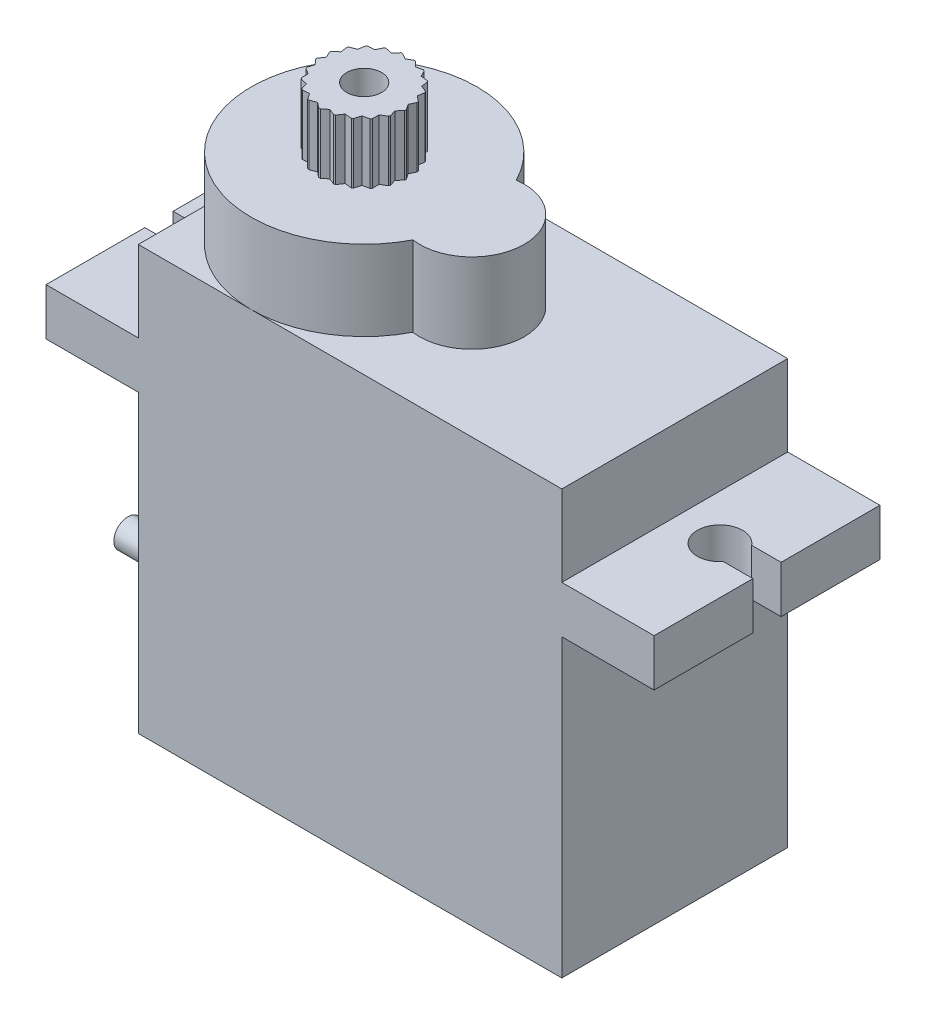
from build123d import *

# Parameters (mm, degrees)
SKETCH1_W           = 22.5
SKETCH1_H           = 12
BOSS_EXTRUDE1_DEPTH = 11.25
SKETCH3_R           = 6
SKETCH3_R_2         = 2.777492364
BOSS_EXTRUDE3_DEPTH = 4.25
SKETCH4_W           = 4.9
SKETCH4_H           = 12
BOSS_EXTRUDE4_DEPTH = 2.5
SKETCH5_R           = 1.2
CUT_EXTRUDE1_DEPTH  = 2.5
SKETCH6_R           = 0.75
BOSS_EXTRUDE5_DEPTH = 5
SKETCH7_R           = 2.375
BOSS_EXTRUDE6_DEPTH = 3.2
CUT_EXTRUDE2_START  = -3.2
CUT_EXTRUDE2_DEPTH  = 3.2
SKETCH9_R           = 0.925
CUT_EXTRUDE3_DEPTH  = 3.2


with BuildPart() as part:
    # Sketch1 → Boss-Extrude1 (new, symmetric)
    with BuildSketch(Plane(origin=(0, 0, 0), x_dir=(1, 0, 0), z_dir=(0, 1, 0))):
        Rectangle(SKETCH1_W, SKETCH1_H)
    extrude(amount=BOSS_EXTRUDE1_DEPTH, both=True)

    # Sketch3 → Boss-Extrude3 (add)
    with BuildSketch(Plane(origin=(0, 11.25, 0), x_dir=(1, 0, 0), z_dir=(0, 1, 0))):
        with Locations((-5.25, 0)):
            Circle(SKETCH3_R)
        with Locations((0.472507636, 0)):
            Circle(SKETCH3_R_2)
    extrude(amount=BOSS_EXTRUDE3_DEPTH)

    # Sketch4 → Boss-Extrude4 (add)
    with BuildSketch(Plane(origin=(0, 6.95, 0), x_dir=(1, 0, 0), z_dir=(0, 1, 0))):
        with Locations((13.7, 0)):
            Rectangle(SKETCH4_W, SKETCH4_H)
    boss_extrude4 = extrude(amount=-BOSS_EXTRUDE4_DEPTH)

    # Sketch5 → Cut-Extrude1 (cut)
    with BuildSketch(Plane(origin=(0, 6.95, 0), x_dir=(1, 0, 0), z_dir=(0, 1, 0))):
        with BuildLine():
            Line((16.15, -0.75), (16.15, 0.75))
            Line((16.15, 0.75), (14.5867497, 0.75))
            ThreePointArc((14.5867497, 0.75), (14.782276388, 0.397429466), (14.85, 0))
            ThreePointArc((14.85, 0), (14.782276388, -0.397429466), (14.5867497, -0.75))
            Line((14.5867497, -0.75), (16.15, -0.75))
        make_face()
        with Locations((13.65, 0)):
            Circle(SKETCH5_R)
    cut_extrude1 = extrude(amount=-CUT_EXTRUDE1_DEPTH, mode=Mode.SUBTRACT)

    # Mirror1: Boss-Extrude4, Cut-Extrude1 across plane
    add(boss_extrude4.mirror(Plane(origin=(0, 0, 0), x_dir=(0, 0, 1), z_dir=(1, 0, 0))))
    add(cut_extrude1.mirror(Plane(origin=(0, 0, 0), x_dir=(0, 0, 1), z_dir=(1, 0, 0))), mode=Mode.SUBTRACT)

    # Sketch6 → Boss-Extrude5 (add)
    with BuildSketch(Plane.ZY.offset(11.25)):
        with Locations(Location((0, -6.75, 0), (0, 0, 180))):
            Circle(SKETCH6_R)
        with Locations(Location((1.55, -6.75, 0), (0, 0, 180))):
            Circle(SKETCH6_R)
        with Locations(Location((-1.55, -6.75, 0), (0, 0, 180))):
            Circle(SKETCH6_R)
    extrude(amount=BOSS_EXTRUDE5_DEPTH)

    # Sketch7 → Boss-Extrude6 (add)
    with BuildSketch(Plane(origin=(0, 15.5, 0), x_dir=(1, 0, 0), z_dir=(0, 1, 0))):
        with Locations(Location((-5.25, 0, 0), (0, 0, 270))):
            Circle(SKETCH7_R)
    extrude(amount=BOSS_EXTRUDE6_DEPTH)

    # Sketch8 → Cut-Extrude2 (cut)
    with BuildSketch(Plane(origin=(0, 18.7, 0), x_dir=(1, 0, 0), z_dir=(0, 1, 0)).offset(CUT_EXTRUDE2_START)):
        with BuildLine():
            ThreePointArc((-4.939008874, 2.354550811), (-5.25, 2.375), (-5.560991126, 2.354550811))
            Line((-5.560991126, 2.354550811), (-5.25, 2.175))
            Line((-5.25, 2.175), (-4.939008874, 2.354550811))
        make_face()
        with BuildLine():
            ThreePointArc((-4.258809302, 2.158278481), (-4.549956461, 2.269485414), (-4.853158628, 2.341610968))
            Line((-4.853158628, 2.341610968), (-4.608907496, 2.078370853))
            Line((-4.608907496, 2.078370853), (-4.258809302, 2.158278481))
        make_face()
        with BuildLine():
            ThreePointArc((-3.666681374, 1.770233636), (-3.912114862, 1.962317089), (-4.180587228, 2.120608715))
            Line((-4.180587228, 2.120608715), (-4.024778874, 1.797069334))
            Line((-4.024778874, 1.797069334), (-3.666681374, 1.770233636))
        make_face()
        with BuildLine():
            ThreePointArc((-3.215238254, 1.224895765), (-3.393150229, 1.480788279), (-3.603037845, 1.711181072))
            Line((-3.603037845, 1.711181072), (-3.549516526, 1.356090319))
            Line((-3.549516526, 1.356090319), (-3.215238254, 1.224895765))
        make_face()
        with BuildLine():
            ThreePointArc((-2.944592644, 0.570720529), (-3.039174847, 0.867684933), (-3.171828277, 1.149707481))
            Line((-3.171828277, 1.149707481), (-3.225349597, 0.794616728))
            Line((-3.225349597, 0.794616728), (-2.944592644, 0.570720529))
        make_face()
        with BuildLine():
            ThreePointArc((-2.878792595, -0.13416573), (-2.881640982, 0.177483972), (-2.925273387, 0.486077335))
            Line((-2.925273387, 0.486077335), (-3.081081741, 0.162537954))
            Line((-3.081081741, 0.162537954), (-2.878792595, -0.13416573))
        make_face()
        with BuildLine():
            ThreePointArc((-3.02368473, -0.827130775), (-2.934546209, -0.528487218), (-2.885280658, -0.220742916))
            Line((-2.885280658, -0.220742916), (-3.129531791, -0.483983031))
            Line((-3.129531791, -0.483983031), (-3.02368473, -0.827130775))
        make_face()
        with BuildLine():
            ThreePointArc((-3.366394747, -1.446601621), (-3.193189666, -1.1875), (-3.05540362, -0.907949189))
            Line((-3.05540362, -0.907949189), (-3.366394747, -1.0875))
            Line((-3.366394747, -1.0875), (-3.366394747, -1.446601621))
        make_face()
        with BuildLine():
            ThreePointArc((-3.876471356, -1.937535565), (-3.634589748, -1.740998196), (-3.420526102, -1.514480193))
            Line((-3.420526102, -1.514480193), (-3.770624295, -1.594387821))
            Line((-3.770624295, -1.594387821), (-3.876471356, -1.937535565))
        make_face()
        with BuildLine():
            ThreePointArc((-4.508592013, -2.256310971), (-4.21952612, -2.139801061), (-3.948205367, -1.986442985))
            Line((-3.948205367, -1.986442985), (-4.306302867, -1.959607288))
            Line((-4.306302867, -1.959607288), (-4.508592013, -2.256310971))
        make_face()
        with BuildLine():
            ThreePointArc((-5.206590024, -2.374603246), (-4.896024618, -2.348473212), (-4.591554799, -2.281901601))
            Line((-4.591554799, -2.281901601), (-4.925833071, -2.150707047))
            Line((-4.925833071, -2.150707047), (-5.206590024, -2.374603246))
        make_face()
        with BuildLine():
            ThreePointArc((-5.908445201, -2.281901601), (-5.603975382, -2.348473212), (-5.293409976, -2.374603246))
            Line((-5.293409976, -2.374603246), (-5.574166929, -2.150707047))
            Line((-5.574166929, -2.150707047), (-5.908445201, -2.281901601))
        make_face()
        with BuildLine():
            ThreePointArc((-6.551794633, -1.986442985), (-6.28047388, -2.139801061), (-5.991407987, -2.256310971))
            Line((-5.991407987, -2.256310971), (-6.193697133, -1.959607288))
            Line((-6.193697133, -1.959607288), (-6.551794633, -1.986442985))
        make_face()
        with BuildLine():
            ThreePointArc((-7.079473898, -1.514480193), (-6.865410252, -1.740998196), (-6.623528644, -1.937535565))
            Line((-6.623528644, -1.937535565), (-6.729375705, -1.594387821))
            Line((-6.729375705, -1.594387821), (-7.079473898, -1.514480193))
        make_face()
        with BuildLine():
            ThreePointArc((-7.44459638, -0.907949189), (-7.306810334, -1.1875), (-7.133605253, -1.446601621))
            Line((-7.133605253, -1.446601621), (-7.133605253, -1.0875))
            Line((-7.133605253, -1.0875), (-7.44459638, -0.907949189))
        make_face()
        with BuildLine():
            ThreePointArc((-7.614719342, -0.220742916), (-7.565453791, -0.528487218), (-7.47631527, -0.827130775))
            Line((-7.47631527, -0.827130775), (-7.370468209, -0.483983031))
            Line((-7.370468209, -0.483983031), (-7.614719342, -0.220742916))
        make_face()
        with BuildLine():
            ThreePointArc((-7.574726613, 0.486077335), (-7.618359018, 0.177483972), (-7.621207405, -0.13416573))
            Line((-7.621207405, -0.13416573), (-7.418918259, 0.162537954))
            Line((-7.418918259, 0.162537954), (-7.574726613, 0.486077335))
        make_face()
        with BuildLine():
            ThreePointArc((-7.328171723, 1.149707481), (-7.460825153, 0.867684933), (-7.555407356, 0.570720529))
            Line((-7.555407356, 0.570720529), (-7.274650403, 0.794616728))
            Line((-7.274650403, 0.794616728), (-7.328171723, 1.149707481))
        make_face()
        with BuildLine():
            ThreePointArc((-6.896962155, 1.711181072), (-7.106849771, 1.480788279), (-7.284761746, 1.224895765))
            Line((-7.284761746, 1.224895765), (-6.950483474, 1.356090319))
            Line((-6.950483474, 1.356090319), (-6.896962155, 1.711181072))
        make_face()
        with BuildLine():
            ThreePointArc((-6.319412772, 2.120608715), (-6.587885138, 1.962317089), (-6.833318626, 1.770233636))
            Line((-6.833318626, 1.770233636), (-6.475221126, 1.797069334))
            Line((-6.475221126, 1.797069334), (-6.319412772, 2.120608715))
        make_face()
        with BuildLine():
            ThreePointArc((-5.646841372, 2.341610968), (-5.950043539, 2.269485414), (-6.241190698, 2.158278481))
            Line((-6.241190698, 2.158278481), (-5.891092504, 2.078370853))
            Line((-5.891092504, 2.078370853), (-5.646841372, 2.341610968))
        make_face()
    extrude(amount=CUT_EXTRUDE2_DEPTH, mode=Mode.SUBTRACT)

    # Sketch9 → Cut-Extrude3 (cut)
    with BuildSketch(Plane(origin=(0, 18.7, 0), x_dir=(1, 0, 0), z_dir=(0, 1, 0))):
        with Locations(Location((-5.25, 0, 0), (0, 0, 270))):
            Circle(SKETCH9_R)
    extrude(amount=-CUT_EXTRUDE3_DEPTH, mode=Mode.SUBTRACT)


solid = part.part
